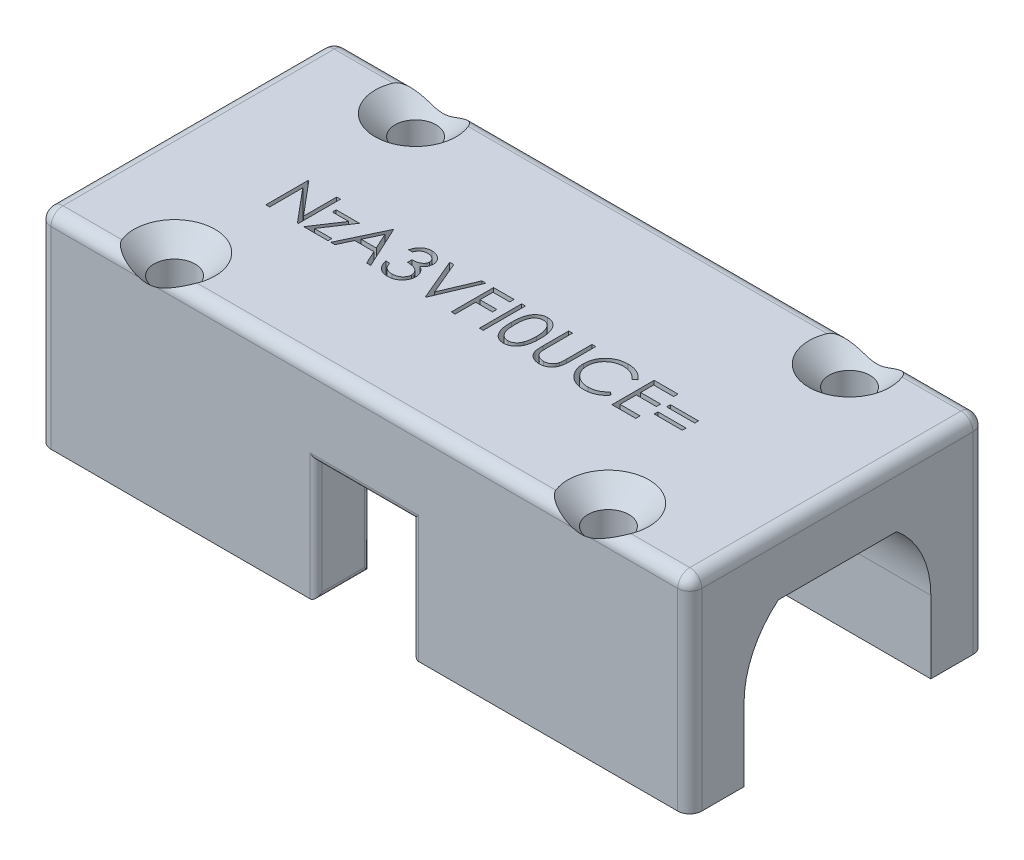
from build123d import *

# Parameters (mm, degrees)
CROQUIS1_W                                           = 54
CROQUIS1_H                                           = 24.5
SALIENTE_EXTRUIR1_DEPTH                              = 17
CORTAR_EXTRUIR3_DEPTH                                = 58.922901343
CROQUIS7_W                                           = 8
CROQUIS7_H                                           = 10
CORTAR_EXTRUIR4_DEPTH                                = 10
CROQUIS8_W                                           = 15.5
CROQUIS8_H                                           = 12
CORTAR_EXTRUIR5_DEPTH                                = 58.922901343
REDONDEO1_R                                          = 1
REFRENTADO_PARA_TORNILLO_TAP_N_CON_CABEZ_D           = 3.4
REFRENTADO_PARA_TORNILLO_TAP_N_CON_CABEZ_CSINK_D     = 6.72
REFRENTADO_PARA_TORNILLO_TAP_N_CON_CABEZ_CSINK_ANGLE = 90
FILLET1_R                                            = 0.5
CORTAR_EXTRUIR6_DEPTH                                = 3.6
CROQUIS19_W                                          = 0.314102565
CROQUIS19_H                                          = 3.5
CROQUIS19_W_2                                        = 2.333333333
CROQUIS19_H_2                                        = 0.314102564
CORTAR_EXTRUIR7_DEPTH                                = 3.7


with BuildPart() as part:
    # Croquis1 → Saliente-Extruir1 (new body)
    with BuildSketch(Plane(origin=(0, 0, 0), x_dir=(1, 0, 0), z_dir=(0, 1, 0))):
        Rectangle(CROQUIS1_W, CROQUIS1_H)
    extrude(amount=SALIENTE_EXTRUIR1_DEPTH)

    # Croquis6 → Cortar-Extruir3 (cut, through all)
    with BuildSketch(Plane(origin=(27, 0, 0), x_dir=(0, 0, -1), z_dir=(1, 0, 0))):
        with BuildLine():
            Line((0, 12), (4.905354218, 12))
            ThreePointArc((4.905354218, 12), (0, -1.75), (-4.905354218, 12))
            Line((-4.905354218, 12), (0, 12))
        make_face()
    extrude(amount=-CORTAR_EXTRUIR3_DEPTH, mode=Mode.SUBTRACT)

    # Croquis7 → Cortar-Extruir4 (cut)
    with BuildSketch(Plane.XY.offset(12.25)):
        with Locations((0, 5)):
            Rectangle(CROQUIS7_W, CROQUIS7_H)
    extrude(amount=-CORTAR_EXTRUIR4_DEPTH, mode=Mode.SUBTRACT)

    # Croquis8 → Cortar-Extruir5 (cut, through all)
    with BuildSketch(Plane(origin=(27, 0, 0), x_dir=(0, 0, -1), z_dir=(1, 0, 0))):
        Rectangle(CROQUIS8_W, CROQUIS8_H)
    extrude(amount=-CORTAR_EXTRUIR5_DEPTH, mode=Mode.SUBTRACT)

    # Redondeo1
    redondeo1_edges = [part.edges().sort_by_distance(p)[0] for p in [
        (-27, 17, 0),
        (0, 17, 12.25),
        (27, 17, 0),
        (0, 17, -12.25),
        (27, 8.5, 12.25),
        (-27, 8.5, 12.25),
        (-27, 8.5, -12.25),
        (27, 8.5, -12.25),
    ]]
    fillet(redondeo1_edges, radius=REDONDEO1_R)

    # Refrentado para tornillo tapón con cabeza plana de clavija de M31 (through all)
    with Locations(Plane(origin=(-18, 17, -10), x_dir=(0, 0, 1), z_dir=(0, 1, 0))):
        with Locations((0, 0), (0, 36), (20, 36), (20, 0)):
            CounterSinkHole(REFRENTADO_PARA_TORNILLO_TAP_N_CON_CABEZ_D / 2, REFRENTADO_PARA_TORNILLO_TAP_N_CON_CABEZ_CSINK_D / 2, counter_sink_angle=REFRENTADO_PARA_TORNILLO_TAP_N_CON_CABEZ_CSINK_ANGLE)

    # Fillet1
    fillet1_edges = [part.edges().sort_by_distance(p)[0] for p in [
        (-4, 8.075851339, 7.466816003),
        (4, 5, 12.25),
        (0, 10, 12.25),
        (-4, 5, 12.25),
        (-4, 0, 10),
        (-4, 3, 7.75),
        (4, 0, 10),
        (4, 8.075851339, 7.466816003),
        (4, 3, 7.75),
    ]]
    fillet(fillet1_edges, radius=FILLET1_R)

    # Croquis18 → Cortar-Extruir6 (cut)
    with BuildSketch(Plane(origin=(0, 0, -12.25), x_dir=(-1, 0, 0), z_dir=(0, 0, -1))):
        Polygon((-1.2, 10.088259494), (-0.7, 10.088259494), (-0.7, 9.088259494), (-1.2, 9.088259494), (-1.7, 9.088259494), (-1.7, 10.088259494), align=None)
        Polygon((-2.4, 10.088259494), (-1.9, 10.088259494), (-1.9, 9.088259494), (-2.4, 9.088259494), (-2.9, 9.088259494), (-2.9, 10.088259494), align=None)
        Polygon((-3.6, 10.088259494), (-3.1, 10.088259494), (-3.1, 9.088259494), (-3.6, 9.088259494), (-4.1, 9.088259494), (-4.1, 10.088259494), align=None)
        Polygon((-2.4, 11.288259494), (-1.9, 11.288259494), (-1.9, 10.288259494), (-2.4, 10.288259494), (-2.9, 10.288259494), (-2.9, 11.288259494), align=None)
        Polygon((-3.6, 8.888259494), (-3.1, 8.888259494), (-3.1, 7.888259494), (-3.6, 7.888259494), (-4.1, 7.888259494), (-4.1, 8.888259494), align=None)
        Polygon((-4.8, 8.888259494), (-4.3, 8.888259494), (-4.3, 7.888259494), (-4.8, 7.888259494), (-5.3, 7.888259494), (-5.3, 8.888259494), align=None)
        Polygon((-4.8, 7.688259494), (-4.3, 7.688259494), (-4.3, 6.688259494), (-4.8, 6.688259494), (-5.3, 6.688259494), (-5.3, 7.688259494), align=None)
        Polygon((-3.6, 7.688259494), (-3.1, 7.688259494), (-3.1, 6.688259494), (-3.6, 6.688259494), (-4.1, 6.688259494), (-4.1, 7.688259494), align=None)
        Polygon((-6, 7.688259494), (-5.5, 7.688259494), (-5.5, 6.688259494), (-6, 6.688259494), (-6.5, 6.688259494), (-6.5, 7.688259494), align=None)
        Polygon((-6, 6.488259494), (-5.5, 6.488259494), (-5.5, 5.488259494), (-6, 5.488259494), (-6.5, 5.488259494), (-6.5, 6.488259494), align=None)
        Polygon((-3.6, 6.488259494), (-3.1, 6.488259494), (-3.1, 5.488259494), (-3.6, 5.488259494), (-4.1, 5.488259494), (-4.1, 6.488259494), align=None)
        Polygon((-3.6, 5.288259494), (-3.1, 5.288259494), (-3.1, 4.288259494), (-3.6, 4.288259494), (-4.1, 4.288259494), (-4.1, 5.288259494), align=None)
        Polygon((-6, 5.288259494), (-5.5, 5.288259494), (-5.5, 4.288259494), (-6, 4.288259494), (-6.5, 4.288259494), (-6.5, 5.288259494), align=None)
        Polygon((-3.6, 4.088259494), (-3.1, 4.088259494), (-3.1, 3.088259494), (-3.6, 3.088259494), (-4.1, 3.088259494), (-4.1, 4.088259494), align=None)
        Polygon((-2.4, 5.288259494), (-1.9, 5.288259494), (-1.9, 4.288259494), (-2.4, 4.288259494), (-2.9, 4.288259494), (-2.9, 5.288259494), align=None)
        Polygon((-2.4, 6.488259494), (-1.9, 6.488259494), (-1.9, 5.488259494), (-2.4, 5.488259494), (-2.9, 5.488259494), (-2.9, 6.488259494), align=None)
        Polygon((-1.2, 6.488259494), (-0.7, 6.488259494), (-0.7, 5.488259494), (-1.2, 5.488259494), (-1.7, 5.488259494), (-1.7, 6.488259494), align=None)
        Polygon((-2.4, 7.688259494), (-1.9, 7.688259494), (-1.9, 6.688259494), (-2.4, 6.688259494), (-2.9, 6.688259494), (-2.9, 7.688259494), align=None)
        Polygon((-1.2, 7.688259494), (-0.7, 7.688259494), (-0.7, 6.688259494), (-1.2, 6.688259494), (-1.7, 6.688259494), (-1.7, 7.688259494), align=None)
        Polygon((-1.2, 8.888259494), (-1.7, 8.888259494), (-1.7, 7.888259494), (-1.2, 7.888259494), (-0.7, 7.888259494), (-0.7, 8.888259494), align=None)
        Polygon((0, 10.088259494), (0.5, 10.088259494), (0.5, 9.088259494), (0, 9.088259494), (-0.5, 9.088259494), (-0.5, 10.088259494), align=None)
        Polygon((0, 8.888259494), (-0.5, 8.888259494), (-0.5, 7.888259494), (0, 7.888259494), (0.5, 7.888259494), (0.5, 8.888259494), align=None)
        Polygon((1.2, 8.888259494), (1.7, 8.888259494), (1.7, 7.888259494), (1.2, 7.888259494), (0.7, 7.888259494), (0.7, 8.888259494), align=None)
        Polygon((1.2, 10.088259494), (1.7, 10.088259494), (1.7, 9.088259494), (1.2, 9.088259494), (0.7, 9.088259494), (0.7, 10.088259494), align=None)
        Polygon((2.4, 11.288259494), (2.9, 11.288259494), (2.9, 10.288259494), (2.4, 10.288259494), (1.9, 10.288259494), (1.9, 11.288259494), align=None)
        Polygon((3.6, 12.488259494), (4.1, 12.488259494), (4.1, 11.488259494), (3.6, 11.488259494), (3.1, 11.488259494), (3.1, 12.488259494), align=None)
        Polygon((2.4, 10.088259494), (2.9, 10.088259494), (2.9, 9.088259494), (2.4, 9.088259494), (1.9, 9.088259494), (1.9, 10.088259494), align=None)
        Polygon((0, 7.688259494), (0.5, 7.688259494), (0.5, 6.688259494), (0, 6.688259494), (-0.5, 6.688259494), (-0.5, 7.688259494), align=None)
        Polygon((1.2, 7.688259494), (1.7, 7.688259494), (1.7, 6.688259494), (1.2, 6.688259494), (0.7, 6.688259494), (0.7, 7.688259494), align=None)
        Polygon((2.4, 7.688259494), (2.9, 7.688259494), (2.9, 6.688259494), (2.4, 6.688259494), (1.9, 6.688259494), (1.9, 7.688259494), align=None)
        Polygon((3.6, 7.688259494), (4.1, 7.688259494), (4.1, 6.688259494), (3.6, 6.688259494), (3.1, 6.688259494), (3.1, 7.688259494), align=None)
        Polygon((0, 6.488259494), (0.5, 6.488259494), (0.5, 5.488259494), (0, 5.488259494), (-0.5, 5.488259494), (-0.5, 6.488259494), align=None)
        Polygon((-1.2, 5.288259494), (-0.7, 5.288259494), (-0.7, 4.288259494), (-1.2, 4.288259494), (-1.7, 4.288259494), (-1.7, 5.288259494), align=None)
        Polygon((0, 5.288259494), (0.5, 5.288259494), (0.5, 4.288259494), (0, 4.288259494), (-0.5, 4.288259494), (-0.5, 5.288259494), align=None)
        Polygon((-1.2, 2.888259494), (-0.7, 2.888259494), (-0.7, 1.888259494), (-1.2, 1.888259494), (-1.7, 1.888259494), (-1.7, 2.888259494), align=None)
        Polygon((1.2, 2.888259494), (1.7, 2.888259494), (1.7, 1.888259494), (1.2, 1.888259494), (0.7, 1.888259494), (0.7, 2.888259494), align=None)
        Polygon((2.4, 2.888259494), (2.9, 2.888259494), (2.9, 1.888259494), (2.4, 1.888259494), (1.9, 1.888259494), (1.9, 2.888259494), align=None)
        Polygon((3.6, 4.088259494), (4.1, 4.088259494), (4.1, 3.088259494), (3.6, 3.088259494), (3.1, 3.088259494), (3.1, 4.088259494), align=None)
        Polygon((3.6, 5.288259494), (4.1, 5.288259494), (4.1, 4.288259494), (3.6, 4.288259494), (3.1, 4.288259494), (3.1, 5.288259494), align=None)
        Polygon((2.4, 5.288259494), (2.9, 5.288259494), (2.9, 4.288259494), (2.4, 4.288259494), (1.9, 4.288259494), (1.9, 5.288259494), align=None)
        Polygon((6, 5.288259494), (6.5, 5.288259494), (6.5, 4.288259494), (6, 4.288259494), (5.5, 4.288259494), (5.5, 5.288259494), align=None)
        Polygon((6, 7.688259494), (6.5, 7.688259494), (6.5, 6.688259494), (6, 6.688259494), (5.5, 6.688259494), (5.5, 7.688259494), align=None)
        Polygon((4.8, 7.688259494), (5.3, 7.688259494), (5.3, 6.688259494), (4.8, 6.688259494), (4.3, 6.688259494), (4.3, 7.688259494), align=None)
        Polygon((5.3, 8.888259494), (5.3, 7.888259494), (4.8, 7.888259494), (4.3, 7.888259494), (4.3, 8.888259494), (4.8, 8.888259494), align=None)
        Polygon((3.6, 8.888259494), (4.1, 8.888259494), (4.1, 7.888259494), (3.6, 7.888259494), (3.1, 7.888259494), (3.1, 8.888259494), align=None)
        Polygon((3.6, 10.088259494), (4.1, 10.088259494), (4.1, 9.088259494), (3.6, 9.088259494), (3.1, 9.088259494), (3.1, 10.088259494), align=None)
        Polygon((1.2, 6.488259494), (1.7, 6.488259494), (1.7, 5.488259494), (1.2, 5.488259494), (0.7, 5.488259494), (0.7, 6.488259494), align=None)
        Polygon((1.2, 5.288259494), (1.7, 5.288259494), (1.7, 4.288259494), (1.2, 4.288259494), (0.7, 4.288259494), (0.7, 5.288259494), align=None)
        Polygon((2.4, 6.488259494), (2.9, 6.488259494), (2.9, 5.488259494), (2.4, 5.488259494), (1.9, 5.488259494), (1.9, 6.488259494), align=None)
        Polygon((3.6, 6.488259494), (4.1, 6.488259494), (4.1, 5.488259494), (3.6, 5.488259494), (3.1, 5.488259494), (3.1, 6.488259494), align=None)
        Polygon((6, 6.488259494), (6.5, 6.488259494), (6.5, 5.488259494), (6, 5.488259494), (5.5, 5.488259494), (5.5, 6.488259494), align=None)
        Polygon((-4.1, 12.488259494), (-4.1, 11.488259494), (-3.6, 11.488259494), (-3.1, 11.488259494), (-3.1, 12.488259494), (-3.6, 12.488259494), align=None)
        Polygon((-2.4, 1.888259494), (-2.9, 1.888259494), (-2.9, 2.888259494), (-2.4, 2.888259494), (-1.9, 2.888259494), (-1.9, 1.888259494), align=None)
    extrude(amount=-CORTAR_EXTRUIR6_DEPTH, mode=Mode.SUBTRACT)

    # Croquis19 → Cortar-Extruir7 (cut)
    # profile 1 of 13: a face of its own
    with BuildSketch(Plane(origin=(0, 17, 0), x_dir=(1, 0, 0), z_dir=(0, 1, 0))):
        Polygon((-17.648255314, -2.77417785), (-17.648255314, 0.72582215), (-17.582349865, 0.72582215), (-15.270050186, -2.028885382), (-15.270050186, 0.72582215), (-14.955947622, 0.72582215), (-14.955947622, -2.77417785), (-15.027462045, -2.77417785), (-17.33415275, -0.025780414), (-17.33415275, -2.77417785), align=None)
    # profile 2 of 13: a face of its own
    with BuildSketch(Plane(origin=(0, 17, 0), x_dir=(1, 0, 0), z_dir=(0, 1, 0))):
        Polygon((-14.372614288, -0.216485542), (-12.443127109, -0.216485542), (-13.930907557, -2.460075286), (-12.487998904, -2.460075286), (-12.487998904, -2.77417785), (-14.507229673, -2.77417785), (-13.018748102, -0.530588106), (-14.372614288, -0.530588106), align=None)
    # profile 3 of 13: a face of its own
    with BuildSketch(Plane(origin=(0, 17, 0), x_dir=(1, 0, 0), z_dir=(0, 1, 0))):
        Polygon((-10.558511724, 0.72582215), (-8.943127109, -2.77417785), (-9.284573423, -2.77417785), (-9.802001307, -1.652382978), (-11.388639929, -1.652382978), (-11.920791372, -2.77417785), (-12.263639929, -2.77417785), (-10.603383519, 0.72582215), align=None)
        Polygon((-10.584453231, 0.043630644), (-11.218267333, -1.293408619), (-9.967466051, -1.293408619), align=None, mode=Mode.SUBTRACT)
    # profile 4 of 13: a face of its own
    with BuildSketch(Plane(origin=(0, 17, 0), x_dir=(1, 0, 0), z_dir=(0, 1, 0))):
        with BuildLine():
            Line((-8.180306596, -0.081870157), (-8.49440916, -0.081870157))
            add(Edge.make_bspline(
                [(-8.49440916, -0.081870157), (-8.485899609, -0.046637673), (-8.469264134, 0.022238951), (-8.43456656, 0.120646212), (-8.396767305, 0.213769733), (-8.351378201, 0.299865807), (-8.301869446, 0.38066471), (-8.245146725, 0.454333834), (-8.183827002, 0.5227468), (-8.116002053, 0.583460037), (-8.044873391, 0.638437766), (-7.969438772, 0.685312824), (-7.891215878, 0.725636977), (-7.809662745, 0.758857208), (-7.724536573, 0.783882732), (-7.63660695, 0.802039538), (-7.54564345, 0.813830652), (-7.483895859, 0.814981415), (-7.452542173, 0.81556574)],
                knots=[0, 0, 0, 0, 1.162005537, 2.271625781, 3.343758855, 4.383309926, 5.390229558, 6.379919256, 7.361854164, 8.333198761, 9.295911338, 10.242430842, 11.177959212, 12.116337295, 13.062827104, 14.020064771, 14.994644689, 16, 16, 16, 16], degree=3))
            add(Edge.make_bspline(
                [(-7.452542173, 0.81556574), (-7.406859431, 0.81418651), (-7.31649042, 0.811458134), (-7.183727373, 0.786543698), (-7.055700554, 0.747118565), (-6.933811306, 0.692644838), (-6.820592873, 0.625457525), (-6.719856687, 0.545492788), (-6.632968176, 0.454293487), (-6.560073798, 0.353560922), (-6.502998799, 0.245905413), (-6.460912426, 0.135105256), (-6.435290745, 0.021423285), (-6.431970188, -0.055333995), (-6.430306596, -0.093789228)],
                knots=[0, 0, 0, 0, 1.083050992, 2.142477498, 3.193116406, 4.255571735, 5.30263384, 6.308962982, 7.297363603, 8.282367274, 9.249857812, 10.179914175, 11.08814088, 12, 12, 12, 12], degree=3))
            add(Edge.make_bspline(
                [(-6.430306596, -0.093789228), (-6.431470187, -0.130796023), (-6.433747154, -0.203212577), (-6.45308086, -0.308934074), (-6.485617123, -0.408575675), (-6.530686885, -0.502556837), (-6.589028435, -0.590281676), (-6.659701132, -0.671947567), (-6.743203794, -0.747916725), (-6.806482732, -0.791436198), (-6.839060602, -0.813841311)],
                knots=[0, 0, 0, 0, 1.024540389, 2.004866551, 2.965041327, 3.920577974, 4.882998113, 5.874504559, 6.905732034, 8, 8, 8, 8], degree=3))
            add(Edge.make_bspline(
                [(-6.839060602, -0.813841311), (-6.801828848, -0.831819483), (-6.728061974, -0.86743944), (-6.627511444, -0.937295198), (-6.536233569, -1.017951545), (-6.48532985, -1.080894198), (-6.459753711, -1.112519196)],
                knots=[0, 0, 0, 0, 1.015518401, 2.012035669, 3.001164323, 4, 4, 4, 4], degree=3))
            add(Edge.make_bspline(
                [(-6.459753711, -1.112519196), (-6.442912369, -1.135576947), (-6.409505473, -1.181314864), (-6.368269939, -1.25485129), (-6.330860825, -1.329202779), (-6.301710606, -1.406362185), (-6.279136739, -1.485435199), (-6.263000706, -1.566557595), (-6.252976566, -1.649795617), (-6.251541014, -1.706108098), (-6.250819416, -1.734414228)],
                knots=[0, 0, 0, 0, 1.025084078, 2.033381695, 3.024893161, 4.013698104, 4.991890475, 5.976764909, 6.982997093, 8, 8, 8, 8], degree=3))
            add(Edge.make_bspline(
                [(-6.250819416, -1.734414228), (-6.25261393, -1.783423949), (-6.256194512, -1.881212751), (-6.288198586, -2.025687473), (-6.337811827, -2.166912975), (-6.408268763, -2.301987814), (-6.494136272, -2.428368195), (-6.596293596, -2.541444504), (-6.713580004, -2.638643108), (-6.844385653, -2.719853337), (-6.986102782, -2.784771259), (-7.137678374, -2.829828702), (-7.296928428, -2.859174701), (-7.406135725, -2.86232157), (-7.461656756, -2.863921439)],
                knots=[0, 0, 0, 0, 0.955779014, 1.907060117, 2.875433937, 3.871313158, 4.872415639, 5.851225146, 6.836215519, 7.83643374, 8.849228613, 9.86973379, 10.916971861, 12, 12, 12, 12], degree=3))
            add(Edge.make_bspline(
                [(-7.461656756, -2.863921439), (-7.499076056, -2.863053226), (-7.572704762, -2.861344872), (-7.68094826, -2.849666271), (-7.784269959, -2.828336266), (-7.882809557, -2.79963296), (-7.976654594, -2.763241218), (-8.065518699, -2.71792252), (-8.149948592, -2.664611018), (-8.229147543, -2.60267743), (-8.303106111, -2.533396091), (-8.369858835, -2.455537081), (-8.430518628, -2.370539677), (-8.483461267, -2.27741662), (-8.53109822, -2.177371363), (-8.570279176, -2.069122865), (-8.604764745, -1.953638843), (-8.620798209, -1.873161103), (-8.629024545, -1.831870157)],
                knots=[0, 0, 0, 0, 1.048658725, 2.063410685, 3.046034179, 4.001477787, 4.936774919, 5.862367409, 6.792675028, 7.730719943, 8.675894397, 9.627829632, 10.600096036, 11.597688215, 12.626045268, 13.701542398, 14.82072376, 16, 16, 16, 16], degree=3))
            Line((-8.629024545, -1.831870157), (-8.314921981, -1.831870157))
            add(Edge.make_bspline(
                [(-8.314921981, -1.831870157), (-8.306738689, -1.858819171), (-8.290821476, -1.911237342), (-8.263727178, -1.986677648), (-8.232858906, -2.055835701), (-8.199744348, -2.119218823), (-8.164965902, -2.177451226), (-8.126050977, -2.228993095), (-8.085881831, -2.276108297), (-8.055602478, -2.302652909), (-8.040783359, -2.315644196)],
                knots=[0, 0, 0, 0, 1.198163088, 2.33053128, 3.407730985, 4.417276592, 5.372219308, 6.28897303, 7.162600585, 8, 8, 8, 8], degree=3))
            add(Edge.make_bspline(
                [(-8.040783359, -2.315644196), (-8.021186782, -2.33075253), (-7.982054119, -2.360922562), (-7.918285888, -2.39942419), (-7.851221002, -2.432785215), (-7.779406328, -2.458268911), (-7.704391558, -2.479846572), (-7.624964192, -2.493967091), (-7.541824975, -2.503655262), (-7.485057212, -2.504510194), (-7.456047782, -2.50494708)],
                knots=[0, 0, 0, 0, 0.946170439, 1.889420265, 2.845303464, 3.807233317, 4.801018734, 5.828864929, 6.890507805, 8, 8, 8, 8], degree=3))
            add(Edge.make_bspline(
                [(-7.456047782, -2.50494708), (-7.423294279, -2.504331175), (-7.359247632, -2.503126826), (-7.265792773, -2.492051119), (-7.176885325, -2.475920705), (-7.0935124, -2.451007723), (-7.014581892, -2.420226871), (-6.941200243, -2.381578466), (-6.872404136, -2.336233744), (-6.809074731, -2.284694585), (-6.752129224, -2.22827309), (-6.70198971, -2.169260019), (-6.659365049, -2.10790419), (-6.624981471, -2.043866069), (-6.59783092, -1.97741084), (-6.57934772, -1.908352011), (-6.566496205, -1.837254744), (-6.565449592, -1.788925775), (-6.564921981, -1.764562465)],
                knots=[0, 0, 0, 0, 1.217147791, 2.380027433, 3.494444702, 4.572153297, 5.609568379, 6.639424714, 7.649109417, 8.668170816, 9.669597737, 10.625200337, 11.543417969, 12.441394052, 13.322311151, 14.205496177, 15.095365482, 16, 16, 16, 16], degree=3))
            add(Edge.make_bspline(
                [(-6.564921981, -1.764562465), (-6.566452282, -1.731951126), (-6.569505271, -1.666890718), (-6.59281385, -1.571173144), (-6.631152714, -1.478949731), (-6.684825226, -1.391793941), (-6.750160954, -1.31101804), (-6.826525861, -1.238946557), (-6.914554089, -1.179476466), (-6.995573958, -1.13838781), (-7.067339115, -1.110350735), (-7.128754499, -1.09167577), (-7.197511103, -1.075862114), (-7.272777452, -1.061149843), (-7.355120668, -1.048628495), (-7.444451106, -1.038186679), (-7.540786868, -1.029831638), (-7.607478034, -1.026100543), (-7.641845057, -1.02417785)],
                knots=[0, 0, 0, 0, 1.07054697, 2.135767047, 3.216561865, 4.33974944, 5.486079747, 6.621378074, 7.775625952, 8.963672916, 9.598146892, 10.304877434, 11.070270905, 11.915000392, 12.823868403, 13.805723172, 14.86925407, 16, 16, 16, 16], degree=3))
            Line((-7.641845057, -1.02417785), (-7.641845057, -0.665203491))
            add(Edge.make_bspline(
                [(-7.641845057, -0.665203491), (-7.598543892, -0.664468687), (-7.513727545, -0.663029387), (-7.38983324, -0.645621377), (-7.271359928, -0.621540749), (-7.160933186, -0.584655556), (-7.060284473, -0.541815259), (-6.972964871, -0.49196305), (-6.900197724, -0.436548301), (-6.842336652, -0.374715691), (-6.798807423, -0.308400644), (-6.766980626, -0.239283986), (-6.7481803, -0.166759925), (-6.745670633, -0.117265257), (-6.74440916, -0.092386984)],
                knots=[0, 0, 0, 0, 1.321986639, 2.589447074, 3.816329219, 5.01088745, 6.139805852, 7.153945165, 8.075214402, 8.924034688, 9.728124013, 10.488707548, 11.240355623, 12, 12, 12, 12], degree=3))
            add(Edge.make_bspline(
                [(-6.74440916, -0.092386984), (-6.744823571, -0.074109239), (-6.745648022, -0.037746532), (-6.7560453, 0.015378537), (-6.771669341, 0.066879483), (-6.79314907, 0.116537293), (-6.821899269, 0.164007567), (-6.856305255, 0.209695016), (-6.897273356, 0.253338795), (-6.944218803, 0.294019114), (-6.994630608, 0.332788351), (-7.049880383, 0.365701988), (-7.108302257, 0.39384705), (-7.169960912, 0.417056553), (-7.235056442, 0.434515841), (-7.303283, 0.447051682), (-7.374770684, 0.454889337), (-7.423542416, 0.456017753), (-7.448335442, 0.456591381)],
                knots=[0, 0, 0, 0, 0.884392785, 1.759457502, 2.611959086, 3.489218968, 4.37281399, 5.2945488, 6.255912374, 7.266815255, 8.301784654, 9.332968512, 10.37626691, 11.440494194, 12.520033166, 13.637162961, 14.798855837, 16, 16, 16, 16], degree=3))
            add(Edge.make_bspline(
                [(-7.448335442, 0.456591381), (-7.48818711, 0.455200019), (-7.566026687, 0.452482365), (-7.678241603, 0.428679352), (-7.782560937, 0.390701269), (-7.862299604, 0.345368249), (-7.921182178, 0.300617815), (-7.963259116, 0.261535429), (-8.004579627, 0.218102605), (-8.042425304, 0.16764423), (-8.08069928, 0.11357744), (-8.115543842, 0.053153758), (-8.149403534, -0.012050636), (-8.169806084, -0.058146271), (-8.180306596, -0.081870157)],
                knots=[0, 0, 0, 0, 1.472543308, 2.876219568, 4.221790263, 5.565193594, 6.249813518, 6.953379497, 7.687249741, 8.463570142, 9.283606569, 10.136032583, 11.040678096, 12, 12, 12, 12], degree=3))
        make_face()
    # profile 5 of 13: a face of its own
    with BuildSketch(Plane(origin=(0, 17, 0), x_dir=(1, 0, 0), z_dir=(0, 1, 0))):
        Polygon((-5.891845057, 0.72582215), (-5.555306596, 0.72582215), (-4.388639929, -2.032390991), (-3.221973263, 0.72582215), (-2.885434801, 0.72582215), (-4.366204032, -2.77417785), (-4.411075827, -2.77417785), align=None)
    # profile 6 of 13: a face of its own
    with BuildSketch(Plane(origin=(0, 17, 0), x_dir=(1, 0, 0), z_dir=(0, 1, 0))):
        Polygon((-2.257229673, 0.72582215), (-0.552101468, 0.72582215), (-0.552101468, 0.366847791), (-1.943127109, 0.366847791), (-1.943127109, -0.710075286), (-0.552101468, -0.710075286), (-0.552101468, -1.069049645), (-1.943127109, -1.069049645), (-1.943127109, -2.77417785), (-2.257229673, -2.77417785), align=None)
    # profile 7 of 13: a face of its own
    with BuildSketch(Plane(origin=(0, 17, 0), x_dir=(1, 0, 0), z_dir=(0, 1, 0))):
        with Locations((0.233154943, -1.02417785)):
            Rectangle(CROQUIS19_W, CROQUIS19_H)
    # profile 8 of 13: a face of its own
    with BuildSketch(Plane(origin=(0, 17, 0), x_dir=(1, 0, 0), z_dir=(0, 1, 0))):
        with BuildLine():
            add(Edge.make_bspline(
                [(0.973539558, -1.025580093), (0.973867576, -0.969482706), (0.974504756, -0.860512721), (0.981593177, -0.701728079), (0.993368519, -0.55276779), (1.009505892, -0.413624724), (1.029143872, -0.28426296), (1.055359359, -0.165028203), (1.085172162, -0.055368596), (1.119724607, 0.045073453), (1.158712396, 0.137651156), (1.201146657, 0.224076357), (1.248711452, 0.304218289), (1.298688364, 0.37935608), (1.353100436, 0.448259774), (1.410399227, 0.511902437), (1.472821103, 0.568813187), (1.538244111, 0.62065949), (1.607260576, 0.666108961), (1.677903242, 0.7061417), (1.750658348, 0.740341567), (1.82572453, 0.767232003), (1.902427088, 0.78944285), (1.981034155, 0.804631798), (2.061675519, 0.814188706), (2.116106954, 0.815102374), (2.143711834, 0.81556574)],
                knots=[0, 0, 0, 0, 1.646270934, 3.197905019, 4.663502075, 6.030701355, 7.308322542, 8.50163776, 9.611534131, 10.641858119, 11.616356847, 12.558055219, 13.465016945, 14.349605745, 15.204443733, 16.039544428, 16.859896111, 17.680448484, 18.487036065, 19.28249412, 20.06191084, 20.843045899, 21.620316918, 22.403196591, 23.190181807, 24, 24, 24, 24], degree=3))
            add(Edge.make_bspline(
                [(2.143711834, 0.81556574), (2.171547312, 0.815077925), (2.226903321, 0.814107814), (2.308743696, 0.804783871), (2.388693378, 0.789312748), (2.466411517, 0.767391774), (2.542536503, 0.740196097), (2.616472911, 0.70610898), (2.688679992, 0.666430113), (2.75801028, 0.619806235), (2.825224895, 0.567823959), (2.888672858, 0.50906129), (2.948359944, 0.444111571), (3.005035249, 0.373669707), (3.057090847, 0.296384622), (3.106664279, 0.213600513), (3.151036315, 0.123869648), (3.19377099, 0.02868918), (3.230657977, -0.074574479), (3.263924222, -0.185339239), (3.290803191, -0.304913426), (3.313192463, -0.432669672), (3.330537359, -0.569077155), (3.343170001, -0.71384347), (3.349843086, -0.867063861), (3.351099787, -0.97182171), (3.351744686, -1.025580093)],
                knots=[0, 0, 0, 0, 0.810914788, 1.612654377, 2.396697861, 3.181598691, 3.963628158, 4.749916497, 5.551656086, 6.361998678, 7.18212741, 8.025565596, 8.878627764, 9.750805457, 10.657531673, 11.591944965, 12.560506719, 13.57287815, 14.630710178, 15.753379473, 16.941251878, 18.199788006, 19.531962791, 20.947069417, 22.433333509, 24, 24, 24, 24], degree=3))
            add(Edge.make_bspline(
                [(3.351744686, -1.025580093), (3.351093102, -1.079104001), (3.349823516, -1.183393153), (3.343244809, -1.335924128), (3.330286178, -1.479922172), (3.314076189, -1.615732634), (3.291625226, -1.742790253), (3.26402006, -1.861534701), (3.233369737, -1.972478773), (3.195534943, -2.074713585), (3.154124233, -2.169665308), (3.109069037, -2.258332456), (3.060799211, -2.341498749), (3.008210466, -2.418498496), (2.952157052, -2.489877153), (2.891439264, -2.554374775), (2.827768679, -2.613545447), (2.760356263, -2.666197075), (2.689944711, -2.712281879), (2.617985635, -2.75349573), (2.543202251, -2.786728425), (2.467289298, -2.815263466), (2.389160932, -2.837063918), (2.308914542, -2.852137773), (2.226958306, -2.862709622), (2.171556741, -2.863516102), (2.143711834, -2.863921439)],
                knots=[0, 0, 0, 0, 1.561518951, 3.042555995, 4.452378317, 5.7783523, 7.031515105, 8.214008947, 9.334062868, 10.386615937, 11.391082383, 12.354592575, 13.286541444, 14.194233754, 15.072674879, 15.931287219, 16.775624067, 17.606195743, 18.42308326, 19.229000347, 20.022332153, 20.807536673, 21.593273796, 22.3848459, 23.188221202, 24, 24, 24, 24], degree=3))
            add(Edge.make_bspline(
                [(2.143711834, -2.863921439), (2.11610772, -2.863455084), (2.061677795, -2.862535522), (1.981025369, -2.853021791), (1.902742926, -2.837726287), (1.826444172, -2.816309683), (1.751737657, -2.790094847), (1.67964137, -2.755941163), (1.609353686, -2.716607094), (1.54106213, -2.671811673), (1.476049969, -2.62048999), (1.413951364, -2.563725701), (1.356326345, -2.50010229), (1.302692249, -2.430624367), (1.251718161, -2.355931124), (1.204828788, -2.275002751), (1.161457934, -2.188160141), (1.121814443, -2.09484223), (1.08666578, -1.993687302), (1.055618071, -1.883538124), (1.031103914, -1.763422488), (1.010120959, -1.634305121), (0.993196576, -1.49563119), (0.98164225, -1.347325412), (0.974500935, -1.189480203), (0.973865865, -1.081210429), (0.973539558, -1.025580093)],
                knots=[0, 0, 0, 0, 0.810891512, 1.598919785, 2.382837074, 3.152667961, 3.926044502, 4.706494248, 5.493654104, 6.291793342, 7.103789334, 7.925228297, 8.761435821, 9.622817696, 10.50288917, 11.416980706, 12.369136599, 13.353924996, 14.394355917, 15.514179734, 16.714354668, 17.994756427, 19.357759367, 20.818452758, 22.365282078, 24, 24, 24, 24], degree=3))
        make_face()
        with BuildLine():
            add(Edge.make_bspline(
                [(1.287642122, -1.02417785), (1.287761569, -1.070926549), (1.287993392, -1.161656593), (1.294049593, -1.293499854), (1.302299825, -1.416470183), (1.312941122, -1.53072372), (1.328744071, -1.635873732), (1.346450858, -1.732643415), (1.367998948, -1.820520652), (1.393493966, -1.900108463), (1.422533063, -1.972757531), (1.454238927, -2.040358747), (1.488299649, -2.103710683), (1.5264188, -2.162244291), (1.567933863, -2.216150455), (1.611907122, -2.266383288), (1.659979707, -2.311180269), (1.726483449, -2.364907124), (1.814279924, -2.420426258), (1.924900379, -2.468772348), (2.03856883, -2.499154804), (2.11572008, -2.50301856), (2.15422866, -2.50494708)],
                knots=[0, 0, 0, 0, 1.459021318, 2.831673884, 4.118529203, 5.306027144, 6.411944654, 7.436330062, 8.375795394, 9.233974572, 10.042671642, 10.816086306, 11.563610507, 12.285937304, 12.993564865, 13.685989202, 14.367179055, 15.041617293, 16.353048772, 17.594441528, 18.799311195, 20, 20, 20, 20], degree=3))
            add(Edge.make_bspline(
                [(2.15422866, -2.50494708), (2.192986332, -2.5033493), (2.270421655, -2.500157037), (2.38355545, -2.469358299), (2.493385721, -2.42288876), (2.579457661, -2.367941255), (2.644940204, -2.315612925), (2.691857194, -2.270998277), (2.734919243, -2.22104241), (2.775761318, -2.167143114), (2.813220393, -2.108270629), (2.847283531, -2.044708054), (2.878366879, -1.976278876), (2.896075925, -1.928509137), (2.905130103, -1.904085702)],
                knots=[0, 0, 0, 0, 1.353760809, 2.704726607, 4.075137775, 5.516104923, 6.260822281, 7.007110065, 7.778089737, 8.566572457, 9.372053459, 10.217411131, 11.088608312, 12, 12, 12, 12], degree=3))
            add(Edge.make_bspline(
                [(2.905130103, -1.904085702), (2.915681871, -1.872855963), (2.937106484, -1.809446199), (2.964718259, -1.711082546), (2.986463658, -1.607879783), (3.006027024, -1.500454666), (3.01938008, -1.388014965), (3.030127893, -1.270908581), (3.03645858, -1.149047219), (3.037243331, -1.066252227), (3.037642122, -1.02417785)],
                knots=[0, 0, 0, 0, 0.884706709, 1.796334032, 2.740027952, 3.714592787, 4.726048262, 5.777819803, 6.87074269, 8, 8, 8, 8], degree=3))
            add(Edge.make_bspline(
                [(3.037642122, -1.02417785), (3.037091933, -0.982110277), (3.036015645, -0.899817112), (3.031901657, -0.779298932), (3.021278083, -0.664831171), (3.009478964, -0.555920698), (2.992081743, -0.453170395), (2.973323936, -0.35572009), (2.948122724, -0.264777065), (2.921202949, -0.178917484), (2.890392553, -0.099116829), (2.856476819, -0.025003043), (2.82025506, 0.043781682), (2.78091282, 0.107048624), (2.738917137, 0.165081166), (2.693159587, 0.216715761), (2.645455215, 0.263552729), (2.578638029, 0.317015298), (2.491163739, 0.371526994), (2.382318092, 0.421692754), (2.269047447, 0.450501046), (2.192473993, 0.454562733), (2.15422866, 0.456591381)],
                knots=[0, 0, 0, 0, 1.31362396, 2.569729283, 3.763502607, 4.902122613, 5.988968491, 7.01645872, 7.998833611, 8.933434873, 9.825090667, 10.667526885, 11.477055099, 12.250526234, 12.991942729, 13.710640831, 14.402115721, 15.076753259, 16.378508321, 17.609869233, 18.806226677, 20, 20, 20, 20], degree=3))
            add(Edge.make_bspline(
                [(2.15422866, 0.456591381), (2.115518068, 0.454559934), (2.038026363, 0.45049334), (1.923578408, 0.421800087), (1.813874056, 0.371787121), (1.726631082, 0.316834748), (1.659767295, 0.264496437), (1.612684602, 0.219109983), (1.56853843, 0.169463728), (1.527870729, 0.115061814), (1.489781446, 0.056596446), (1.454800434, -0.006392318), (1.423283104, -0.074223683), (1.394198568, -0.146840118), (1.36862578, -0.226421063), (1.347531817, -0.314190056), (1.328044763, -0.410651948), (1.314249495, -0.516371456), (1.301985739, -0.630653609), (1.294104391, -0.753930927), (1.287973133, -0.885995308), (1.287754669, -0.977194466), (1.287642122, -1.02417785)],
                knots=[0, 0, 0, 0, 1.207732386, 2.417664972, 3.655092373, 4.956220595, 5.625982001, 6.301752483, 6.994047911, 7.697131622, 8.419323945, 9.170223765, 9.943494443, 10.752040957, 11.610060368, 12.549350801, 13.567764191, 14.679664412, 15.874934091, 17.154273443, 18.533957287, 20, 20, 20, 20], degree=3))
        make_face(mode=Mode.SUBTRACT)
    # profile 9 of 13: a face of its own
    with BuildSketch(Plane(origin=(0, 17, 0), x_dir=(1, 0, 0), z_dir=(0, 1, 0))):
        with BuildLine():
            Line((3.979949814, 0.72582215), (4.294052378, 0.72582215))
            Line((4.294052378, 0.72582215), (4.294052378, -1.371233138))
            add(Edge.make_bspline(
                [(4.294052378, -1.371233138), (4.294005634, -1.400913874), (4.29391693, -1.457238185), (4.294509444, -1.537406485), (4.296168812, -1.608678944), (4.297214972, -1.671330292), (4.299542305, -1.725073039), (4.301440352, -1.77019835), (4.303880909, -1.806492553), (4.306814026, -1.827673479), (4.308074814, -1.83677801)],
                knots=[0, 0, 0, 0, 1.528628734, 2.90083645, 4.128790002, 5.200304208, 6.127813768, 6.898992206, 7.526736466, 8, 8, 8, 8], degree=3))
            add(Edge.make_bspline(
                [(4.308074814, -1.83677801), (4.313252273, -1.869624773), (4.323315459, -1.933467502), (4.348961837, -2.024375784), (4.384779338, -2.106307243), (4.427222381, -2.181818534), (4.483154992, -2.248807894), (4.550158528, -2.310519547), (4.631336296, -2.364491351), (4.721596902, -2.413842163), (4.818882139, -2.453507245), (4.918293406, -2.48350061), (5.018336385, -2.501779509), (5.08531255, -2.503896048), (5.118571609, -2.50494708)],
                knots=[0, 0, 0, 0, 1.035780045, 2.013197591, 2.933192213, 3.817615948, 4.702609284, 5.640816605, 6.646850145, 7.73207398, 8.84249596, 9.914020372, 10.964143139, 12, 12, 12, 12], degree=3))
            add(Edge.make_bspline(
                [(5.118571609, -2.50494708), (5.14712535, -2.50387323), (5.204067911, -2.501731732), (5.288674342, -2.488470301), (5.371074451, -2.464569735), (5.451675131, -2.433729977), (5.527226115, -2.392982386), (5.597769557, -2.345911546), (5.660733491, -2.29070067), (5.718191489, -2.229600326), (5.768226425, -2.160660526), (5.811597567, -2.085382388), (5.847123496, -2.002633041), (5.864667021, -1.944478619), (5.873679782, -1.914602529)],
                knots=[0, 0, 0, 0, 0.994687771, 1.983630487, 2.973142513, 3.978332533, 4.983357753, 5.956394766, 6.925816176, 7.893390482, 8.871859704, 9.88551698, 10.913711441, 12, 12, 12, 12], degree=3))
            add(Edge.make_bspline(
                [(5.873679782, -1.914602529), (5.876679908, -1.902253955), (5.883365396, -1.874736355), (5.889612441, -1.828215064), (5.896118966, -1.7733257), (5.900633536, -1.709673887), (5.905034757, -1.637472915), (5.907667829, -1.556346657), (5.908884862, -1.466589697), (5.909247543, -1.403952535), (5.909436994, -1.371233138)],
                knots=[0, 0, 0, 0, 0.558680831, 1.244966039, 2.062412453, 2.990489873, 4.051219941, 5.244515665, 6.560634259, 8, 8, 8, 8], degree=3))
            Line((5.909436994, -1.371233138), (5.909436994, 0.72582215))
            Line((5.909436994, 0.72582215), (6.223539558, 0.72582215))
            Line((6.223539558, 0.72582215), (6.223539558, -1.388060061))
            add(Edge.make_bspline(
                [(6.223539558, -1.388060061), (6.223285438, -1.42615844), (6.222789506, -1.500509743), (6.21848893, -1.609461102), (6.21163193, -1.712814083), (6.201943842, -1.81058258), (6.189106839, -1.902416739), (6.174831618, -1.989121507), (6.156652085, -2.0700745), (6.135418684, -2.145906918), (6.111145136, -2.218092431), (6.079703988, -2.286601046), (6.044279488, -2.353515445), (6.002264835, -2.417823554), (5.955053452, -2.479810107), (5.901601771, -2.539099182), (5.84367761, -2.596638229), (5.780318051, -2.650951295), (5.712567526, -2.700759972), (5.640627568, -2.744557743), (5.565050798, -2.78158136), (5.486033672, -2.812057285), (5.403542469, -2.834971884), (5.317575109, -2.85204704), (5.227935916, -2.861749337), (5.16697126, -2.863191267), (5.136099654, -2.863921439)],
                knots=[0, 0, 0, 0, 1.316592851, 2.569410997, 3.76748051, 4.895814652, 5.963796859, 6.97159953, 7.931736103, 8.829262218, 9.692595152, 10.560224239, 11.431080259, 12.30701507, 13.211635791, 14.121146779, 15.063487852, 16.031507147, 17.00238618, 17.966455255, 18.938106653, 19.907068911, 20.888905087, 21.893141452, 22.933117798, 24, 24, 24, 24], degree=3))
            add(Edge.make_bspline(
                [(5.136099654, -2.863921439), (5.102430551, -2.863136674), (5.036371893, -2.861596968), (4.939033825, -2.852774217), (4.845719629, -2.836155823), (4.755443752, -2.814995879), (4.669435255, -2.785812142), (4.58654181, -2.751714017), (4.508183129, -2.709836757), (4.433088001, -2.663243364), (4.363263245, -2.610818726), (4.299165841, -2.553678552), (4.240689971, -2.492738174), (4.188821274, -2.427337809), (4.14270039, -2.357986102), (4.102970177, -2.284486862), (4.068856932, -2.206868546), (4.051250365, -2.152915345), (4.042349654, -2.125640189)],
                knots=[0, 0, 0, 0, 1.13879206, 2.234305948, 3.301075583, 4.341971843, 5.366689343, 6.369221514, 7.369726634, 8.367512178, 9.355451585, 10.318319045, 11.268648973, 12.207971039, 13.137398894, 14.081662264, 15.030215811, 16, 16, 16, 16], degree=3))
            add(Edge.make_bspline(
                [(4.042349654, -2.125640189), (4.037172496, -2.107007615), (4.025943124, -2.066593146), (4.013917827, -1.999706658), (4.003808745, -1.92269174), (3.994303187, -1.835543122), (3.988694229, -1.738193255), (3.98377679, -1.630684339), (3.979915172, -1.512886377), (3.979937944, -1.430831862), (3.979949814, -1.388060061)],
                knots=[0, 0, 0, 0, 0.625038921, 1.35572334, 2.194682327, 3.136881307, 4.189498639, 5.346923369, 6.617055217, 8, 8, 8, 8], degree=3))
            Line((3.979949814, -1.388060061), (3.979949814, 0.72582215))
        make_face()
    # profile 10 of 13: a face of its own
    with BuildSketch(Plane(origin=(0, 17, 0), x_dir=(1, 0, 0), z_dir=(0, 1, 0))):
        with BuildLine():
            Line((10.351744686, 0.083594586), (10.076904943, -0.126741952))
            add(Edge.make_bspline(
                [(10.076904943, -0.126741952), (10.057299054, -0.103375982), (10.018351607, -0.056959067), (9.955692405, 0.008220478), (9.890390762, 0.069285739), (9.822471641, 0.126527619), (9.750712521, 0.177944385), (9.676851723, 0.226215487), (9.599653677, 0.269483225), (9.492901943, 0.321946212), (9.353254094, 0.376692367), (9.177459255, 0.422595598), (8.993948157, 0.451816774), (8.868750557, 0.454981615), (8.805070007, 0.456591381)],
                knots=[0, 0, 0, 0, 0.757959112, 1.505699292, 2.245454638, 2.979532153, 3.711538275, 4.438200793, 5.171680507, 5.909471876, 7.393775596, 8.890124382, 10.418191784, 12, 12, 12, 12], degree=3))
            add(Edge.make_bspline(
                [(8.805070007, 0.456591381), (8.769986707, 0.456187419), (8.700145715, 0.455383243), (8.596497241, 0.444774117), (8.49478419, 0.429862907), (8.395072724, 0.407737584), (8.297489765, 0.379764965), (8.201397363, 0.346339551), (8.108186763, 0.304984711), (8.016568525, 0.259276451), (7.928789314, 0.207649007), (7.845734266, 0.151335655), (7.767706299, 0.090966558), (7.694643686, 0.026315452), (7.626471738, -0.042326509), (7.563684427, -0.11569085), (7.506499017, -0.193543024), (7.453781992, -0.274856431), (7.406569259, -0.359394223), (7.367039379, -0.447469293), (7.332034257, -0.537573396), (7.304335014, -0.630724557), (7.282410498, -0.726267323), (7.267282834, -0.824458111), (7.256794363, -0.925091791), (7.255994186, -0.993301103), (7.25559084, -1.027683459)],
                knots=[0, 0, 0, 0, 1.054917814, 2.100044995, 3.131103042, 4.146048494, 5.169673617, 6.183595914, 7.203665975, 8.234915748, 9.262203917, 10.264457458, 11.251630812, 12.227803204, 13.197192746, 14.159520551, 15.12972552, 16.100847026, 17.073214652, 18.039054194, 19.002613845, 19.979014051, 20.95965708, 21.949030935, 22.966165397, 24, 24, 24, 24], degree=3))
            add(Edge.make_bspline(
                [(7.25559084, -1.027683459), (7.256852659, -1.079414779), (7.259330073, -1.180982363), (7.281378407, -1.329752974), (7.314883499, -1.472273648), (7.365099076, -1.60765349), (7.427018126, -1.737561848), (7.505258738, -1.859800702), (7.595875275, -1.976217266), (7.700149694, -2.084060214), (7.81455551, -2.182573939), (7.937303422, -2.269324521), (8.06808771, -2.341639403), (8.20546434, -2.40181535), (8.350490454, -2.448072077), (8.502905256, -2.480636201), (8.662377252, -2.501878381), (8.771346651, -2.503912069), (8.826804782, -2.50494708)],
                knots=[0, 0, 0, 0, 1.029171465, 2.020641659, 2.987623507, 3.938342917, 4.889210282, 5.84687017, 6.821220943, 7.821438502, 8.827599549, 9.822697543, 10.807740252, 11.797342354, 12.80366471, 13.83203677, 14.896651826, 16, 16, 16, 16], degree=3))
            add(Edge.make_bspline(
                [(8.826804782, -2.50494708), (8.887907471, -2.503258301), (9.00817218, -2.499934378), (9.184540207, -2.471775129), (9.353375972, -2.426117211), (9.514688559, -2.362219289), (9.668023205, -2.279154001), (9.813619865, -2.178456124), (9.951601436, -2.059167791), (10.034572718, -1.968084663), (10.076904943, -1.921613747)],
                knots=[0, 0, 0, 0, 1.028121516, 2.023589091, 2.998037872, 3.967518031, 4.937445131, 5.927275754, 6.942489185, 8, 8, 8, 8], degree=3))
            Line((10.076904943, -1.921613747), (10.351744686, -2.12984692))
            add(Edge.make_bspline(
                [(10.351744686, -2.12984692), (10.329626576, -2.158385372), (10.285496301, -2.215325578), (10.214038284, -2.295597288), (10.138760987, -2.371101324), (10.059105277, -2.441228945), (9.975987485, -2.50738341), (9.887915173, -2.567685242), (9.79604614, -2.622976126), (9.700691661, -2.673603051), (9.601953048, -2.718520298), (9.499948613, -2.756974065), (9.395118038, -2.790098955), (9.28745653, -2.817350892), (9.176740773, -2.838621975), (9.063370299, -2.85284165), (8.947100423, -2.862583565), (8.868659002, -2.863471481), (8.828908148, -2.863921439)],
                knots=[0, 0, 0, 0, 0.986787822, 1.968848986, 2.935600012, 3.899624008, 4.868462664, 5.837806735, 6.815139263, 7.798259679, 8.787526145, 9.778297419, 10.776456485, 11.791383307, 12.812564526, 13.85620153, 14.913611965, 16, 16, 16, 16], degree=3))
            add(Edge.make_bspline(
                [(8.828908148, -2.863921439), (8.791264481, -2.863659447), (8.71682879, -2.863141389), (8.606930039, -2.854749222), (8.499940458, -2.843299485), (8.396165832, -2.826059354), (8.295039857, -2.805715014), (8.197479273, -2.778443757), (8.102524062, -2.74789459), (8.010555722, -2.711989604), (7.921496022, -2.671473421), (7.83563221, -2.625681862), (7.753003778, -2.574999998), (7.672798357, -2.520544987), (7.596200774, -2.460567685), (7.522547248, -2.395901051), (7.451424772, -2.32676304), (7.407422087, -2.276908187), (7.385298372, -2.251842113)],
                knots=[0, 0, 0, 0, 1.114604814, 2.203992996, 3.262667896, 4.300477797, 5.318619304, 6.316056647, 7.298880507, 8.271930387, 9.238335007, 10.195173496, 11.151986948, 12.108099108, 13.064862484, 14.031167946, 15.010108607, 16, 16, 16, 16], degree=3))
            add(Edge.make_bspline(
                [(7.385298372, -2.251842113), (7.349862728, -2.208300924), (7.279419252, -2.121744213), (7.189293568, -1.981458232), (7.112146013, -1.834990023), (7.049770092, -1.681570094), (7.001007359, -1.521542707), (6.967226164, -1.354827193), (6.945274559, -1.18157925), (6.942764271, -1.063742462), (6.941488276, -1.003845318)],
                knots=[0, 0, 0, 0, 0.994628077, 1.977248131, 2.950237994, 3.925870899, 4.908910175, 5.911660606, 6.938484602, 8, 8, 8, 8], degree=3))
            add(Edge.make_bspline(
                [(6.941488276, -1.003845318), (6.943043469, -0.940889864), (6.946103216, -0.81702894), (6.972099011, -0.635254986), (7.013917807, -0.461103587), (7.073314696, -0.294899843), (7.148620047, -0.135769563), (7.241646661, 0.015071642), (7.351313803, 0.158588442), (7.476761371, 0.292603193), (7.614328706, 0.415142546), (7.76164752, 0.52294875), (7.918429467, 0.612666266), (8.082947319, 0.687662428), (8.256433, 0.745306891), (8.438516369, 0.785660078), (8.628855284, 0.810777194), (8.75871771, 0.813952402), (8.824701417, 0.81556574)],
                knots=[0, 0, 0, 0, 1.032925535, 2.032216505, 3.007276963, 3.968222605, 4.92396291, 5.891752235, 6.871517503, 7.883894988, 8.900124299, 9.891468569, 10.874487609, 11.85992873, 12.854644235, 13.869047385, 14.917252991, 16, 16, 16, 16], degree=3))
            add(Edge.make_bspline(
                [(8.824701417, 0.81556574), (8.864915889, 0.815083602), (8.944516386, 0.814129258), (9.062269039, 0.804823116), (9.176911365, 0.78930951), (9.288522347, 0.76819344), (9.397644964, 0.741986118), (9.503445205, 0.70784582), (9.606543891, 0.668809289), (9.7062908, 0.623850823), (9.80220735, 0.573384081), (9.894263668, 0.517968458), (9.981728527, 0.457672652), (10.065217375, 0.393009477), (10.143333586, 0.322610917), (10.218295065, 0.248413322), (10.287556143, 0.168279497), (10.330309338, 0.111874563), (10.351744686, 0.083594586)],
                knots=[0, 0, 0, 0, 1.096760587, 2.17092713, 3.219439832, 4.250915756, 5.268269357, 6.278326846, 7.281116186, 8.274029601, 9.260640565, 10.235837813, 11.203064059, 12.156899882, 13.114053108, 14.069676657, 15.032185724, 16, 16, 16, 16], degree=3))
        make_face()
    # profile 11 of 13: a face of its own
    with BuildSketch(Plane(origin=(0, 17, 0), x_dir=(1, 0, 0), z_dir=(0, 1, 0))):
        Polygon((11.069693404, 0.72582215), (13.044052378, 0.72582215), (13.044052378, 0.366847791), (11.383795968, 0.366847791), (11.383795968, -0.710075286), (13.044052378, -0.710075286), (13.044052378, -1.069049645), (11.383795968, -1.069049645), (11.383795968, -2.415203491), (13.044052378, -2.415203491), (13.044052378, -2.77417785), (11.069693404, -2.77417785), align=None)
    # profile 12 of 13: a face of its own
    with BuildSketch(Plane(origin=(0, 17, 0), x_dir=(1, 0, 0), z_dir=(0, 1, 0))):
        with Locations((14.659436994, -0.508152209)):
            Rectangle(CROQUIS19_W_2, CROQUIS19_H_2)
    # profile 13 of 13: a face of its own
    with BuildSketch(Plane(origin=(0, 17, 0), x_dir=(1, 0, 0), z_dir=(0, 1, 0))):
        with Locations((14.659436994, -1.540203491)):
            Rectangle(CROQUIS19_W_2, CROQUIS19_H_2)
    extrude(amount=-CORTAR_EXTRUIR7_DEPTH, mode=Mode.SUBTRACT)


solid = part.part
